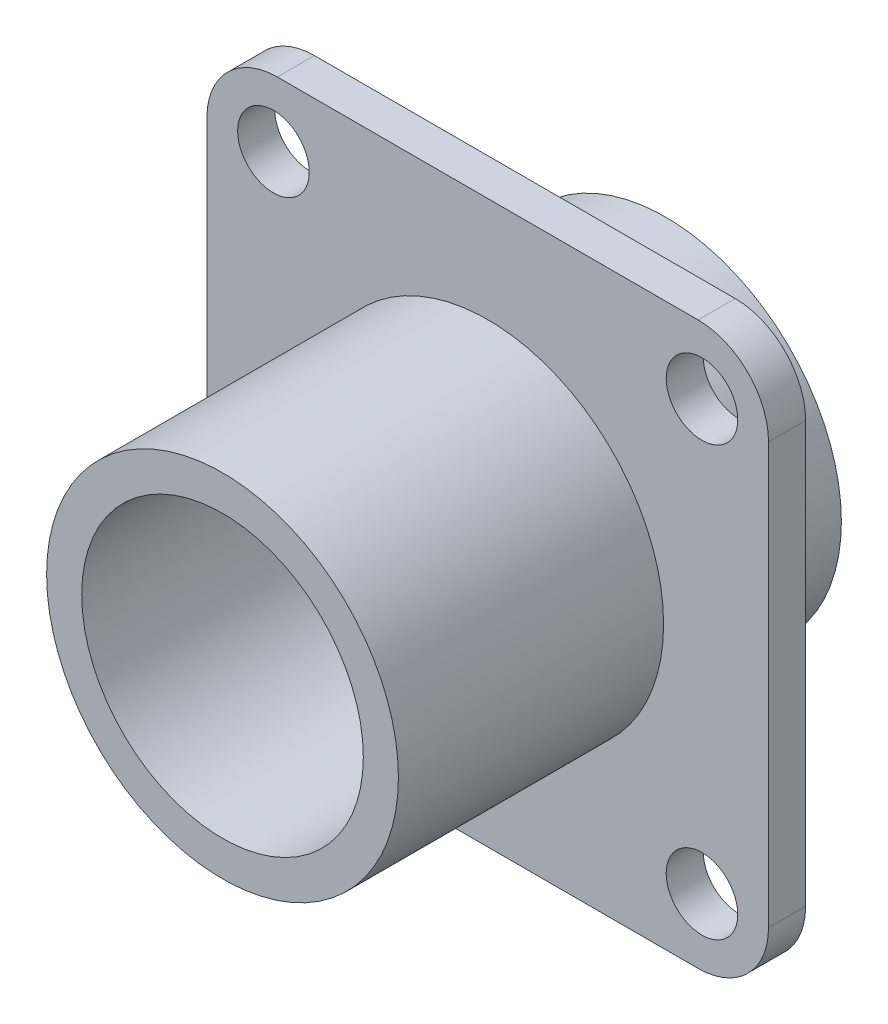
from build123d import *

# Parameters (mm, degrees)
SKETCH_1_W                  = 23.93
SKETCH_1_H                  = 23.93
EXTRUDE_1_DEPTH             = 1.58
SKETCH_2_W                  = 7.495
SKETCH_2_H                  = 11.3
SKETCH_3_W                  = 7.49
SKETCH_3_H                  = 7.44
HOLE_WIZARD_M2_51_D         = 3.05
HOLE_WIZARD_M2_51_DEPTH     = 12.88
HOLE_WIZARD_12_0_12_1_D     = 12
HOLE_WIZARD_12_0_12_1_DEPTH = 10
FILLET_1_R                  = 3
CUT_EXTRUDE_START           = -15
SKETCH_8_R                  = 6
CUT_EXTRUDE_1_DEPTH         = 15
SKETCH_9_R                  = 7.49
SKETCH_9_R_2                = 6
CUT_EXTRUDE_3_DEPTH         = 1.44


with BuildPart() as part:
    # Эскиз1 → Бобышка-Вытянуть1 (new body)
    with BuildSketch(Plane(origin=(0, 0, 0), x_dir=(-1, 0, 0), z_dir=(0, 0, -1))):
        Rectangle(SKETCH_1_W, SKETCH_1_H)
    extrude(amount=-EXTRUDE_1_DEPTH)

    # Эскиз2 → Повернуть1 (revolve)
    with BuildSketch(Plane(origin=(0, 0, 0), x_dir=(1, 0, 0), z_dir=(0, 1, 0))):
        with Locations((3.7475, -7.23)):
            Rectangle(SKETCH_2_W, SKETCH_2_H)
    revolve(axis=Axis((0, 0, 1.58), (0, 0, 1)))

    # Эскиз3 → Повернуть2 (revolve)
    with BuildSketch(Plane.XZ, mode=Mode.PRIVATE) as revolve_2_sk:
        with Locations((3.745, -3.72)):
            Rectangle(SKETCH_3_W, SKETCH_3_H)
    revolve(revolve_2_sk.sketch.rotate(Axis((0, 0, 0), (0, 0, -1)), 180), axis=Axis((0, 0, 0), (0, 0, -1)))

    # Отверстие с зазором M2.51
    with Locations(Plane(origin=(0, 0, 0), x_dir=(-1, 0, 0), z_dir=(0, 0, -1))):
        with Locations((9.13, -9.13), (9.13, 9.13), (-9.13, 9.13), (-9.13, -9.13)):
            Hole(HOLE_WIZARD_M2_51_D / 2, depth=HOLE_WIZARD_M2_51_DEPTH)

    # Диаметр отверстия Ø12.0 (12)1
    with Locations(Plane.XY.offset(12.88)):
        with Locations((0, 0)):
            Hole(HOLE_WIZARD_12_0_12_1_D / 2, depth=HOLE_WIZARD_12_0_12_1_DEPTH)

    # Скругление1
    fillet_1_edges = [part.edges().sort_by_distance(p)[0] for p in [
        (11.965, -11.965, 0.79),
        (11.965, 11.965, 0.79),
        (-11.965, 11.965, 0.79),
        (-11.965, -11.965, 0.79),
    ]]
    fillet(fillet_1_edges, radius=FILLET_1_R)

    # Эскиз8 → Вырез-Вытянуть1 (cut)
    with BuildSketch(Plane.XY.offset(2.88).offset(CUT_EXTRUDE_START)):
        Circle(SKETCH_8_R)
    extrude(amount=CUT_EXTRUDE_1_DEPTH, mode=Mode.SUBTRACT)

    # Эскиз9 → Вырез-Вытянуть3 (cut)
    with BuildSketch(Plane(origin=(0, 0, -7.44), x_dir=(-1, 0, 0), z_dir=(0, 0, -1))):
        Circle(SKETCH_9_R)
        with Locations(Location((0, 0, 0), (0, 0, 180))):
            Circle(SKETCH_9_R_2, mode=Mode.SUBTRACT)
    extrude(amount=-CUT_EXTRUDE_3_DEPTH, mode=Mode.SUBTRACT)


solid = part.part
